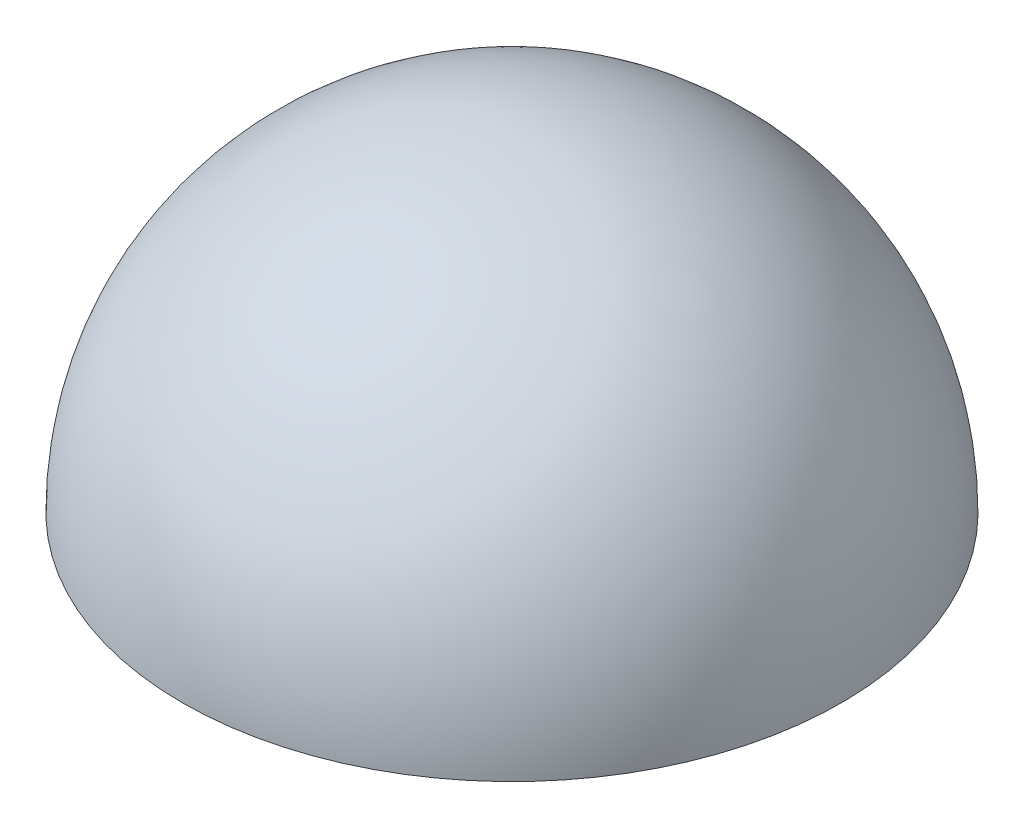
from build123d import *

# Parameters (mm, degrees)
REVOLVE1_ANGLE = 180
SHELL1_T       = -1.27


with BuildPart() as part:
    # Sketch1 → Revolve1 (revolve)
    with BuildSketch(Plane(origin=(0, 0, 0), x_dir=(1, 0, 0), z_dir=(0, 1, 0))):
        with BuildLine():
            Line((-23.902987763, -1.939306601), (26.897007466, -1.961324102))
            ThreePointArc((26.897007466, -1.961324102), (1.508018602, 23.449682263), (-23.902987763, -1.939306601))
        make_face()
    revolve(axis=Axis((-23.902987763, 0, 1.939306601), (0.9999999060755533, 0, 0.00043341537180254555)), revolution_arc=REVOLVE1_ANGLE)

    # Shell1
    shell1_openings = [part.faces().sort_by_distance(p)[0] for p in [
        (1.497009851, 0, 1.950315351),
    ]]
    offset(amount=SHELL1_T, openings=shell1_openings)


solid = part.part
